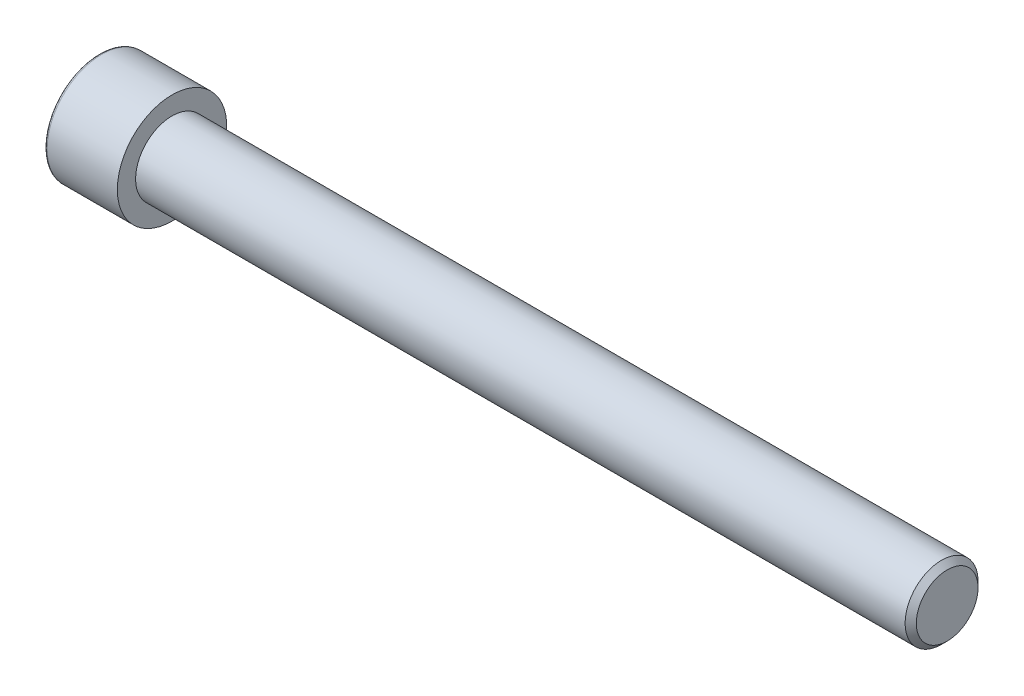
from build123d import *

# Parameters (mm, degrees)
SZKIC1_W                    = 16
SZKIC1_H                    = 12
SZKIC5_R                    = 9
DODANIE_WYCI_GNI_CIE1_DEPTH = 12


with BuildPart() as part:
    # Szkic1 → Obrót1 (revolve)
    with BuildSketch(Plane.XY):
        with Locations((8, 6)):
            Rectangle(SZKIC1_W, SZKIC1_H)
    revolve(axis=Axis((16, 0, 0), (-1, 0, 0)))

    # Szkic2 → Wycięcie-obrót1 (revolve, cut)
    with BuildSketch(Plane.XY):
        with BuildLine():
            Line((0, 12), (0, 11.4))
            ThreePointArc((0, 11.4), (0.175735931, 11.824264069), (0.6, 12))
            Line((0.6, 12), (0, 12))
        make_face()
    revolve(axis=Axis((16, 0, 0), (-1, 0, 0)), mode=Mode.SUBTRACT)

    # Szkic3 → Obrót2 (revolve)
    with BuildSketch(Plane.XY):
        Polygon((16, 0), (16, 8), (184.773, 8), (186, 6.773), (186, 0), align=None)
    revolve(axis=Axis((186, 0, 0), (-1, 0, 0)))

    # Szkic4 → Wycięcie-obrót2 (revolve, cut)
    with BuildSketch(Plane.XY):
        Polygon((0, 0), (0, 8.5), (8, 8.5), (12.907477288, 0), align=None)
    revolve(axis=Axis((12.907477288, 0, 0), (-1, 0, 0)), mode=Mode.SUBTRACT)

    # Szkic5 → Dodanie-wyciągnięcie1 (add)
    with BuildSketch(Plane(origin=(0, 0, 0), x_dir=(0, 0, -1), z_dir=(1, 0, 0))):
        Circle(SZKIC5_R)
        Polygon((-7, 4.041451884), (-7, -4.041451884), (0, -8.082903769), (7, -4.041451884), (7, 4.041451884), (0, 8.082903769), align=None, mode=Mode.SUBTRACT)
    extrude(amount=DODANIE_WYCI_GNI_CIE1_DEPTH)


solid = part.part
